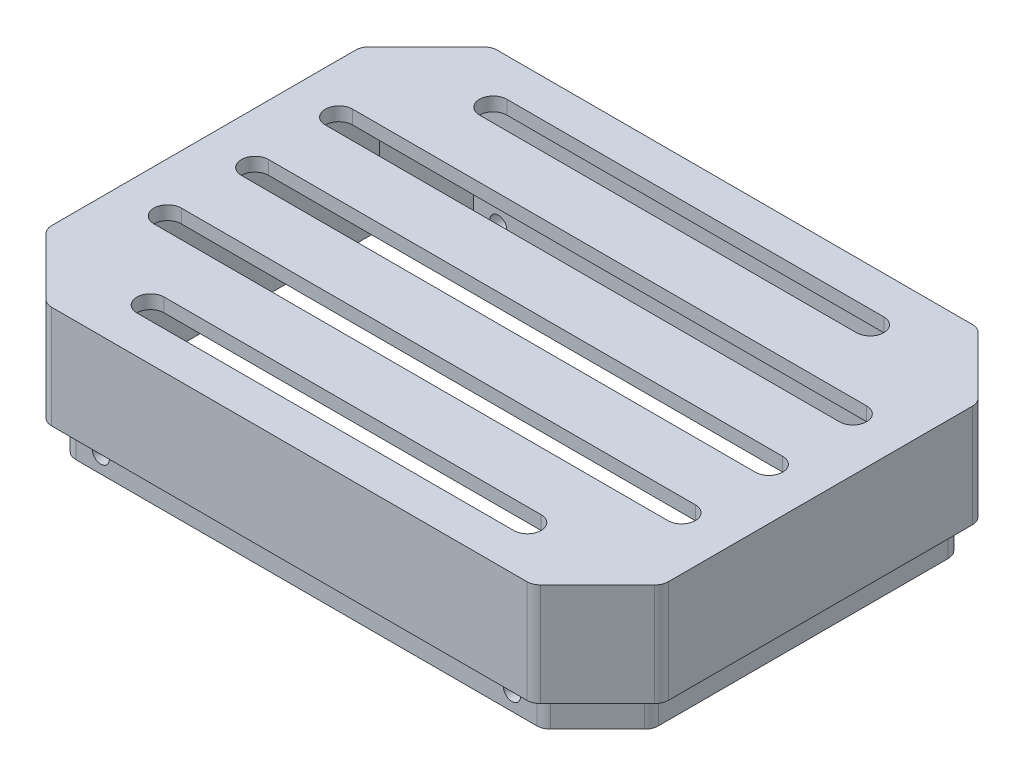
from build123d import *

# Parameters (mm, degrees)
BOSS_EXTRUDE1_DEPTH = 25.4
CUT_EXTRUDE1_DEPTH  = 6.35
CUT_EXTRUDE2_DEPTH  = 22.86
SKETCH4_R           = 1.575
CUT_EXTRUDE3_DEPTH  = 102.052823439
CUT_EXTRUDE4_DEPTH  = 75.93269063
FILLET1_R           = 2.54


with BuildPart() as part:
    # Sketch1 → Boss-Extrude1 (new body)
    with BuildSketch(Plane(origin=(0, 0, 0), x_dir=(1, 0, 0), z_dir=(0, 1, 0))):
        Polygon((-45.085, -41.275), (-57.15, -29.21), (-57.15, 29.21), (-45.085, 41.275), (45.085, 41.275), (57.15, 29.21), (57.15, -29.21), (45.085, -41.275), align=None)
    extrude(amount=BOSS_EXTRUDE1_DEPTH)

    # Sketch2 → Cut-Extrude1 (cut)
    with BuildSketch(Plane.XZ):
        Polygon((-57.15, 29.21), (-57.15, -29.21), (-45.085, -41.275), (45.085, -41.275), (57.15, -29.21), (57.15, 29.21), (45.085, 41.275), (-45.085, 41.275), align=None)
        Polygon((-53.975, 27.894871939), (-53.975, -27.894871939), (-43.769871939, -38.1), (43.769871939, -38.1), (53.975, -27.894871939), (53.975, 27.894871939), (43.769871939, 38.1), (-43.769871939, 38.1), align=None, mode=Mode.SUBTRACT)
    extrude(amount=-CUT_EXTRUDE1_DEPTH, mode=Mode.SUBTRACT)

    # Sketch3 → Cut-Extrude2 (cut)
    with BuildSketch(Plane.XZ):
        Polygon((-51.435, 26.842769491), (-51.435, -26.842769491), (-42.717769491, -35.56), (42.717769491, -35.56), (51.435, -26.842769491), (51.435, 26.842769491), (42.717769491, 35.56), (-42.717769491, 35.56), align=None)
    extrude(amount=-CUT_EXTRUDE2_DEPTH, mode=Mode.SUBTRACT)

    # Sketch4 → Cut-Extrude3 (cut, through all)
    with BuildSketch(Plane.XY.offset(38.1)):
        with Locations((-38.1, 3.175)):
            Circle(SKETCH4_R)
        with Locations((38.1, 3.175)):
            Circle(SKETCH4_R)
    extrude(amount=-CUT_EXTRUDE3_DEPTH, mode=Mode.SUBTRACT)

    # Sketch5 → Cut-Extrude4 (cut, through all)
    with BuildSketch(Plane(origin=(0, 25.4, 0), x_dir=(1, 0, 0), z_dir=(0, 1, 0))):
        with BuildLine():
            Line((-35.239850105, 34.29), (34.610149895, 34.29))
            ThreePointArc((34.610149895, 34.29), (37.150149895, 31.75), (34.610149895, 29.21))
            Line((34.610149895, 29.21), (-35.239850105, 29.21))
            ThreePointArc((-35.239850105, 29.21), (-37.779850105, 31.75), (-35.239850105, 34.29))
        make_face()
        with BuildLine():
            Line((-47.625, 2.54), (47.625, 2.54))
            ThreePointArc((47.625, 2.54), (50.165, 0), (47.625, -2.54))
            Line((47.625, -2.54), (-47.625, -2.54))
            ThreePointArc((-47.625, -2.54), (-50.165, 0), (-47.625, 2.54))
        make_face()
        with BuildLine():
            Line((-35.239850105, -29.21), (34.610149895, -29.21))
            ThreePointArc((34.610149895, -29.21), (37.150149895, -31.75), (34.610149895, -34.29))
            Line((34.610149895, -34.29), (-35.239850105, -34.29))
            ThreePointArc((-35.239850105, -34.29), (-37.779850105, -31.75), (-35.239850105, -29.21))
        make_face()
        with BuildLine():
            Line((-47.939850105, -13.335), (47.310149895, -13.335))
            ThreePointArc((47.310149895, -13.335), (49.850149895, -15.875), (47.310149895, -18.415))
            Line((47.310149895, -18.415), (-47.939850105, -18.415))
            ThreePointArc((-47.939850105, -18.415), (-50.479850105, -15.875), (-47.939850105, -13.335))
        make_face()
        with BuildLine():
            Line((-47.939850105, 18.415), (47.310149895, 18.415))
            ThreePointArc((47.310149895, 18.415), (49.850149895, 15.875), (47.310149895, 13.335))
            Line((47.310149895, 13.335), (-47.939850105, 13.335))
            ThreePointArc((-47.939850105, 13.335), (-50.479850105, 15.875), (-47.939850105, 18.415))
        make_face()
    extrude(amount=-CUT_EXTRUDE4_DEPTH, mode=Mode.SUBTRACT)

    # Fillet1
    fillet1_edges = [part.edges().sort_by_distance(p)[0] for p in [
        (-45.085, 15.875, 41.275),
        (-57.15, 15.875, 29.21),
        (-57.15, 15.875, -29.21),
        (-45.085, 15.875, -41.275),
        (45.085, 15.875, -41.275),
        (57.15, 15.875, -29.21),
        (57.15, 15.875, 29.21),
        (45.085, 15.875, 41.275),
        (-43.769871939, 3.175, 38.1),
        (43.769871939, 3.175, 38.1),
        (53.975, 3.175, 27.894871939),
        (53.975, 3.175, -27.894871939),
        (43.769871939, 3.175, -38.1),
        (-43.769871939, 3.175, -38.1),
        (-53.975, 3.175, -27.894871939),
        (-53.975, 3.175, 27.894871939),
    ]]
    fillet(fillet1_edges, radius=FILLET1_R)


solid = part.part
